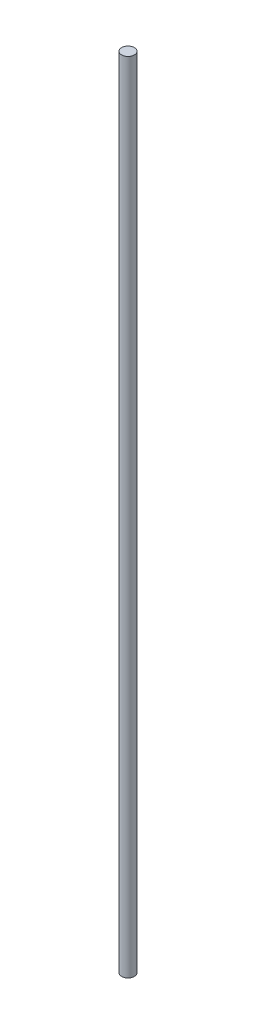
from build123d import *

# Parameters (mm, degrees)
SKETCH1_R           = 6
BOSS_EXTRUDE1_DEPTH = 750


with BuildPart() as part:
    # Sketch1 → Boss-Extrude1 (new body)
    with BuildSketch(Plane(origin=(0, 0, 0), x_dir=(1, 0, 0), z_dir=(0, 1, 0))):
        with Locations(Location((0, 0, 0), (0, 0, 270))):
            Circle(SKETCH1_R)
    extrude(amount=BOSS_EXTRUDE1_DEPTH)


solid = part.part
